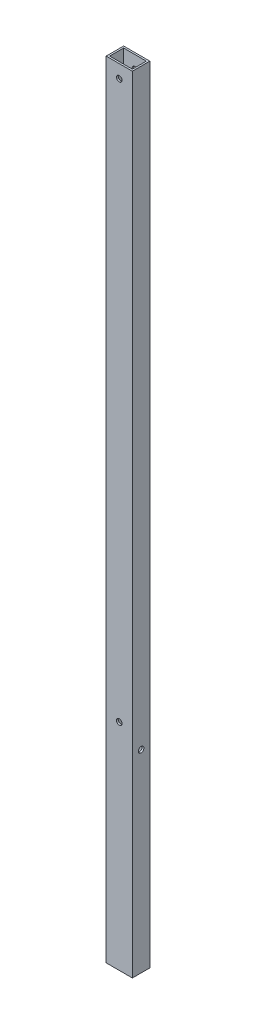
from build123d import *

# Parameters (mm, degrees)
SKETCH_1_W          = 15
SKETCH_1_H          = 475.958242536
SKETCH_1_R          = 1.6
EXTRUDE_1_DEPTH     = 10
SKETCH_2_W          = 15
SKETCH_2_H          = 25.958242536
CUT_EXTRUDE_1_DEPTH = 100
SKETCH_4_R          = 1.6
CUT_EXTRUDE_2_DEPTH = 15
SKETCH_5_W          = 13
SKETCH_5_H          = 8
CUT_EXTRUDE_3_DEPTH = 1000


with BuildPart() as part:
    # ｽｹｯﾁ1 → ﾎﾞｽ - 押し出し1 (new body)
    with BuildSketch(Plane.XY.offset(464.498723907)):
        with Locations((-7.5, 237.979121268)):
            Rectangle(SKETCH_1_W, SKETCH_1_H)
        with Locations((-7.5, 468.458242536)):
            Circle(SKETCH_1_R, mode=Mode.SUBTRACT)
        with Locations((-7.5, 149.274909628)):
            Circle(SKETCH_1_R, mode=Mode.SUBTRACT)
    extrude(amount=-EXTRUDE_1_DEPTH)

    # ｽｹｯﾁ2 → ｶｯﾄ - 押し出し1 (cut)
    with BuildSketch(Plane.XY.offset(464.498723907)):
        with Locations((-7.5, 12.979121268)):
            Rectangle(SKETCH_2_W, SKETCH_2_H)
    extrude(amount=-CUT_EXTRUDE_1_DEPTH, mode=Mode.SUBTRACT)

    # ｽｹｯﾁ4 → ｶｯﾄ - 押し出し2 (cut)
    with BuildSketch(Plane.ZY.offset(15)):
        with Locations(Location((459.498723907, 136.774909628, 0), (0, 0, 270))):
            Circle(SKETCH_4_R)
    extrude(amount=-CUT_EXTRUDE_2_DEPTH, mode=Mode.SUBTRACT)

    # ｽｹｯﾁ5 → ｶｯﾄ - 押し出し3 (cut)
    with BuildSketch(Plane(origin=(0, 475.958242536, 0), x_dir=(1, 0, 0), z_dir=(0, 1, 0))):
        with Locations((-7.5, -459.498723907)):
            Rectangle(SKETCH_5_W, SKETCH_5_H)
    extrude(amount=-CUT_EXTRUDE_3_DEPTH, mode=Mode.SUBTRACT)


solid = part.part
